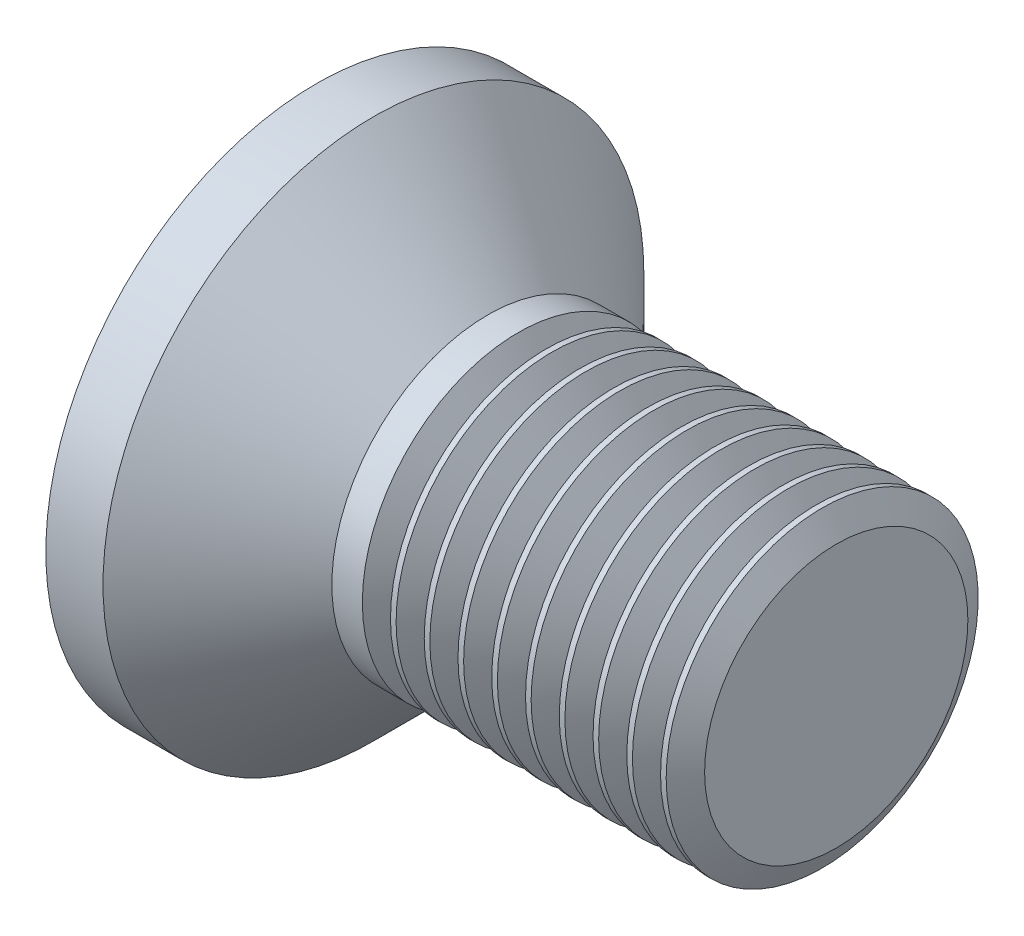
from build123d import *

# Parameters (mm, degrees)
CROSSRECESS_DEPTH = 0.825
DRAFT9_ANGLE      = 30
FILLET5_R         = 0.3
LPATTERN10_COUNT  = 10
LPATTERN10_PITCH  = 0.3246


with BuildPart() as part:
    # Sketch1 → Base (revolve)
    with BuildSketch(Plane.XY, mode=Mode.PRIVATE) as base_sk:
        Polygon((5, 1.5), (2.65, 1.5), (1.65, 1.5), (0.55, 2.6), (0, 2.6), (0, 0), (5, 0), align=None)
    revolve(base_sk.sketch.rotate(Axis((4.515812911, 0, 0), (-1, 0, 0)), 90), axis=Axis((4.515812911, 0, 0), (-1, 0, 0)))

    # Sketch6 → CrossRecess (cut)
    with BuildSketch(Plane(origin=(0, 0, 0), x_dir=(0, 0, -1), z_dir=(1, 0, 0))):
        Polygon((0.32, 0.32), (0.32, 1.6), (-0.32, 1.6), (-0.32, 0.32), (-1.6, 0.32), (-1.6, -0.32), (-0.32, -0.32), (-0.32, -1.6), (0.32, -1.6), (0.32, -0.32), (1.6, -0.32), (1.6, 0.32), align=None)
    extrude(amount=CROSSRECESS_DEPTH, mode=Mode.SUBTRACT)

    # Draft9
    draft9_faces = [part.faces().sort_by_distance(p)[0] for p in [
        (0.4125, 1.6, 0),
        (0.4125, 0, 1.6),
        (0.4125, -1.6, 0),
        (0.4125, 0, -1.6),
    ]]
    draft(draft9_faces, Plane(origin=(0, 2.6, 0), x_dir=(0, 0, -1), z_dir=(-1, 0, 0)), DRAFT9_ANGLE)

    # Fillet5
    fillet5_edges = [part.edges().sort_by_distance(p)[0] for p in [
        (0.4125, 0.32, 0.32),
        (0.4125, -0.32, 0.32),
        (0.4125, -0.32, -0.32),
        (0.4125, 0.32, -0.32),
    ]]
    fillet(fillet5_edges, radius=FILLET5_R)

    # Sketch9 → Cut-Revolve10 (revolve, cut)
    with BuildSketch(Plane.XY, mode=Mode.PRIVATE) as cut_revolve10_sk:
        Polygon((5, 1.265740128), (5.13525, 1.5), (5.13525, 1.7705), (4.86475, 1.7705), (4.86475, 1.5), align=None)
    cut_revolve10 = revolve(cut_revolve10_sk.sketch.rotate(Axis((0, 0, 0), (1, 0, 0)), 270), axis=Axis((0, 0, 0), (1, 0, 0)), mode=Mode.SUBTRACT)

    # LPattern10: Cut-Revolve10 ×10
    with Locations(*[(-i * LPATTERN10_PITCH, 0, 0) for i in range(1, LPATTERN10_COUNT)]):
        add(cut_revolve10, mode=Mode.SUBTRACT)


solid = part.part
